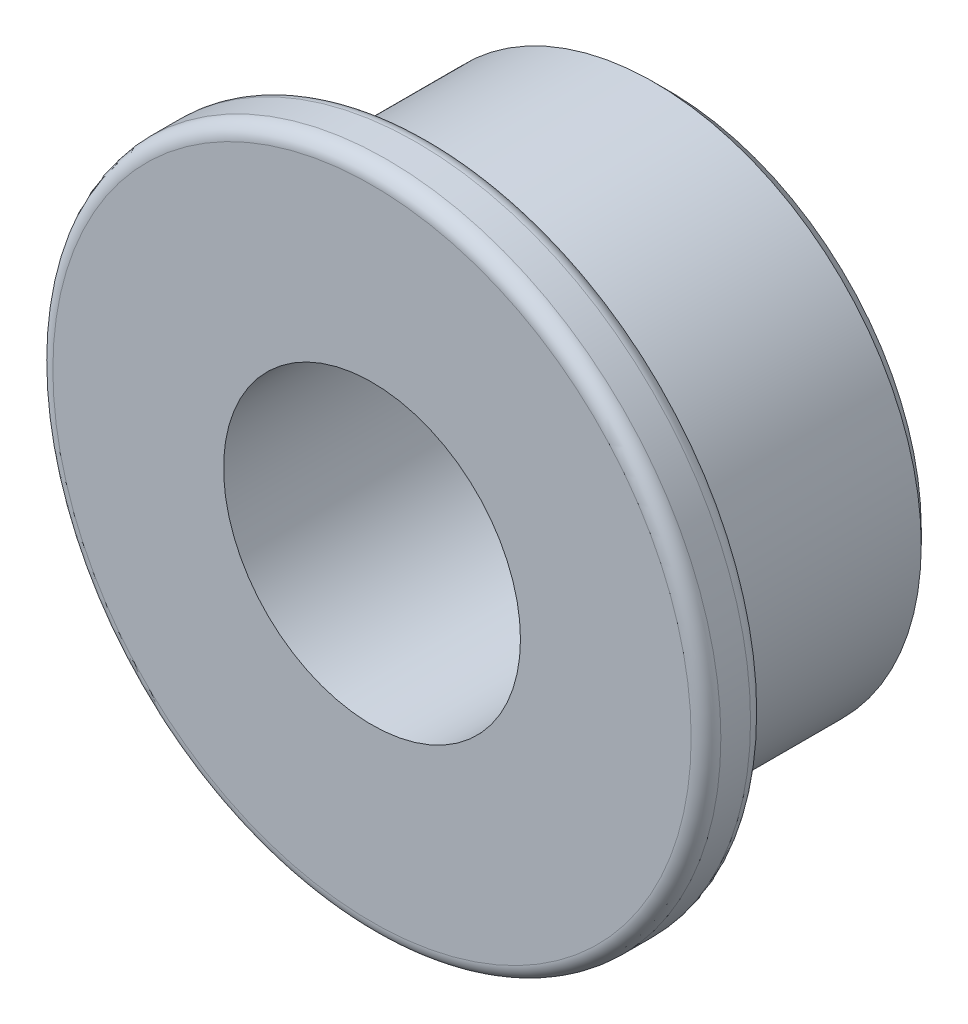
from build123d import *

# Parameters (mm, degrees)
SKETCH1_R           = 9
SKETCH1_R_2         = 5
BOSS_EXTRUDE1_DEPTH = 8
BOSS_EXTRUDE2_START = 2
SKETCH2_R           = 11.25
SKETCH2_R_2         = 5
BOSS_EXTRUDE2_DEPTH = 2
FILLET1_R           = 0.5
FILLET2_R           = 0.5
FILLET3_R           = 0.8
CHAMFER1_SIZE       = 0.5


with BuildPart() as part:
    # Sketch1 → Boss-Extrude1 (new body)
    with BuildSketch(Plane.XY):
        Circle(SKETCH1_R)
        Circle(SKETCH1_R_2, mode=Mode.SUBTRACT)
    extrude(amount=-BOSS_EXTRUDE1_DEPTH)

    # Sketch2 → Boss-Extrude2 (add)
    with BuildSketch(Plane.XY.offset(BOSS_EXTRUDE2_START)):
        Circle(SKETCH2_R)
        Circle(SKETCH2_R_2, mode=Mode.SUBTRACT)
    extrude(amount=-BOSS_EXTRUDE2_DEPTH)

    # Fillet1
    fillet1_edges = [part.edges().sort_by_distance(p)[0] for p in [
        (-11.25, 0, 2),
    ]]
    fillet(fillet1_edges, radius=FILLET1_R)

    # Fillet2
    fillet2_edges = [part.edges().sort_by_distance(p)[0] for p in [
        (-11.25, 0, 0),
    ]]
    fillet(fillet2_edges, radius=FILLET2_R)

    # Fillet3
    fillet3_edges = [part.edges().sort_by_distance(p)[0] for p in [
        (-9, 0, 0),
    ]]
    fillet(fillet3_edges, radius=FILLET3_R)

    # Chamfer1
    chamfer1_edges = [part.edges().sort_by_distance(p)[0] for p in [
        (-9, 0, -8),
    ]]
    chamfer(chamfer1_edges, length=CHAMFER1_SIZE)


solid = part.part
